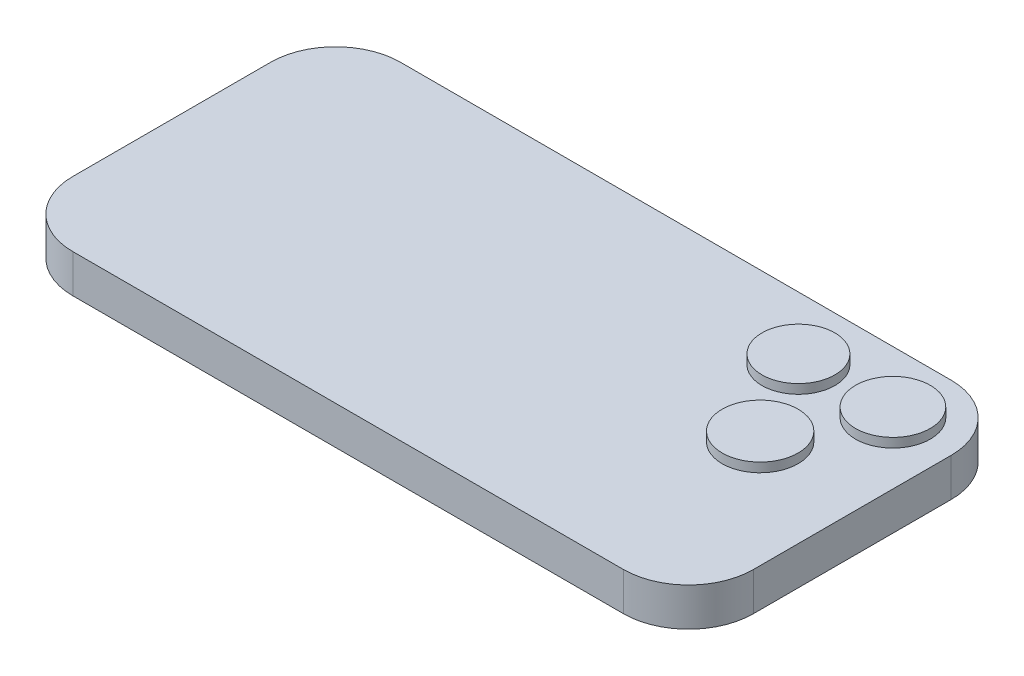
from build123d import *

# Parameters (mm, degrees)
SKETCH1_W           = 146.6
SKETCH1_H           = 70.6
BOSS_EXTRUDE1_DEPTH = 8.25
FILLET1_R           = 14
SKETCH2_R           = 7.8441354
SKETCH2_R_2         = 8.049819652
SKETCH2_R_3         = 8.178113635
BOSS_EXTRUDE2_DEPTH = 2


with BuildPart() as part:
    # Sketch1 → Boss-Extrude1 (new body)
    with BuildSketch(Plane(origin=(0, 0, 0), x_dir=(1, 0, 0), z_dir=(0, 1, 0))):
        Rectangle(SKETCH1_W, SKETCH1_H)
    extrude(amount=BOSS_EXTRUDE1_DEPTH)

    # Fillet1
    fillet1_edges = [part.edges().sort_by_distance(p)[0] for p in [
        (-73.3, 4.125, -35.3),
        (73.3, 4.125, -35.3),
        (73.3, 4.125, 35.3),
        (-73.3, 4.125, 35.3),
    ]]
    fillet(fillet1_edges, radius=FILLET1_R)

    # Sketch2 → Boss-Extrude2 (add)
    with BuildSketch(Plane(origin=(0, 8.25, 0), x_dir=(1, 0, 0), z_dir=(0, 1, 0))):
        with Locations(Location((39.929810702, 21.760044193, 0), (0, 0, 270))):
            Circle(SKETCH2_R)
        with Locations(Location((59.990850443, 22.050286799, 0), (0, 0, 270))):
            Circle(SKETCH2_R_2)
        with Locations(Location((50.210763803, 3.237335299, 0), (0, 0, 270))):
            Circle(SKETCH2_R_3)
    extrude(amount=BOSS_EXTRUDE2_DEPTH)


solid = part.part
